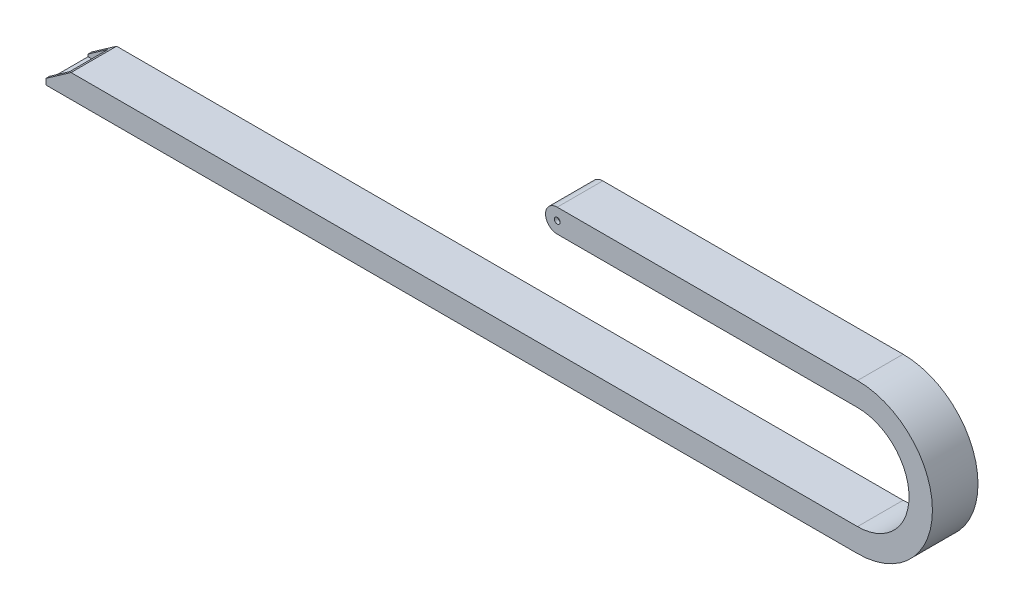
from build123d import *

# Parameters (mm, degrees)
BOSS_EXTRUDE1_DEPTH = 39
SHELL1_T            = -3
SKETCH2_W           = 33
SKETCH2_H           = 14
CUT_EXTRUDE1_DEPTH  = 730.858236947
SKETCH3_R           = 2.5
CUT_EXTRUDE2_DEPTH  = 504.042108716


with BuildPart() as part:
    # Sketch1 → Boss-Extrude1 (new body)
    with BuildSketch(Plane.XY):
        with BuildLine():
            Line((385.962547752, -201.25), (-287.036202121, -201.25))
            Line((-287.036202121, -201.25), (-308.458422222, -216.25))
            Line((-308.458422222, -216.25), (-308.458422222, -221.25))
            Line((-308.458422222, -221.25), (385.962547752, -221.25))
            ThreePointArc((385.962547752, -221.25), (450.087547752, -157.125), (385.962547752, -93))
            Line((385.962547752, -93), (129, -93))
            ThreePointArc((129, -93), (119, -103), (129, -113))
            Line((129, -113), (385.962547752, -113))
            ThreePointArc((385.962547752, -113), (430.087547752, -157.125), (385.962547752, -201.25))
        make_face()
    extrude(amount=BOSS_EXTRUDE1_DEPTH)

    # Shell1
    shell1_openings = [part.faces().sort_by_distance(p)[0] for p in [
        (-297.747312172, -208.75, 19.5),
    ]]
    offset(amount=SHELL1_T, openings=shell1_openings, kind=Kind.INTERSECTION)

    # Sketch2 → Cut-Extrude1 (cut, through all)
    with BuildSketch(Plane.ZY.offset(-385.962547752)):
        with Locations((19.5, -103)):
            Rectangle(SKETCH2_W, SKETCH2_H)
        with Locations((19.5, -211.25)):
            Rectangle(SKETCH2_W, SKETCH2_H)
    extrude(amount=CUT_EXTRUDE1_DEPTH, mode=Mode.SUBTRACT)

    # Sketch3 → Cut-Extrude2 (cut, through all)
    with BuildSketch(Plane.XY.offset(39)):
        with Locations((129, -103)):
            Circle(SKETCH3_R)
    extrude(amount=-CUT_EXTRUDE2_DEPTH, mode=Mode.SUBTRACT)


solid = part.part
